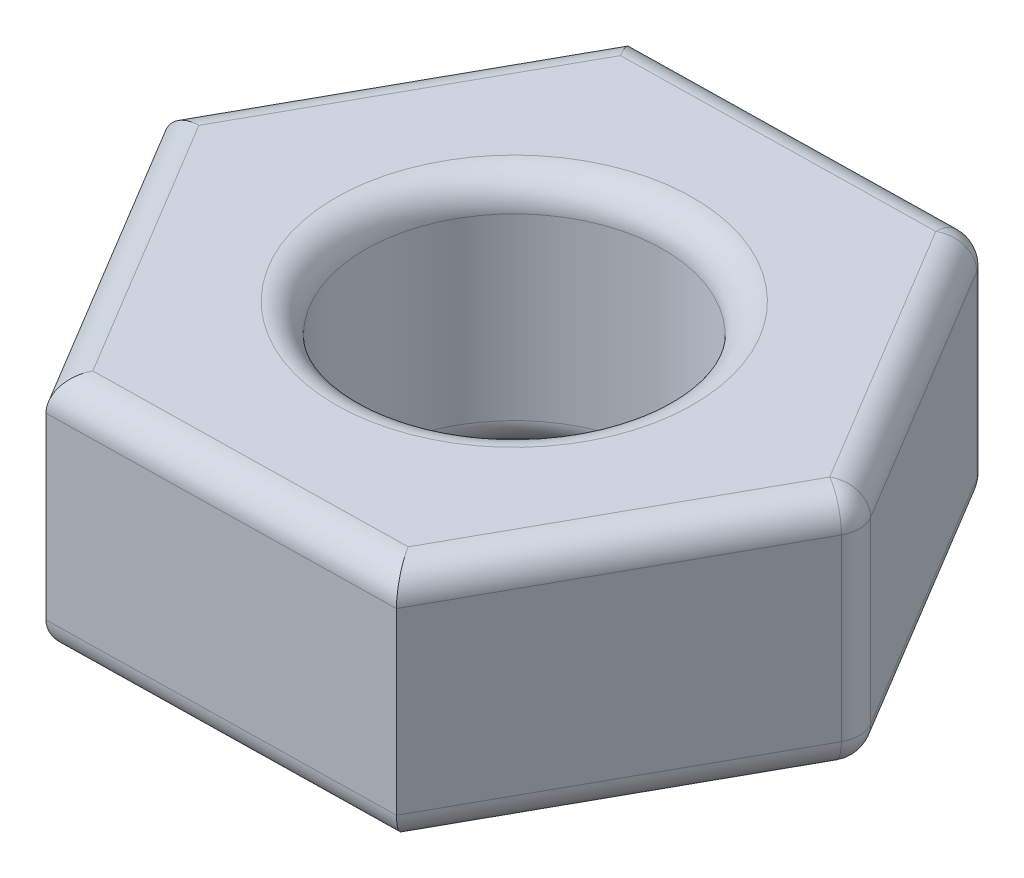
from build123d import *

# Parameters (mm, degrees)
SKETCH_1_R      = 1
EXTRUDE_1_DEPTH = 1.6
FILLET_1_R      = 0.2


with BuildPart() as part:
    # 草图1 → 凸台-拉伸1 (new body)
    with BuildSketch(Plane(origin=(0, 0, 0), x_dir=(1, 0, 0), z_dir=(0, 1, 0))):
        Polygon((1.119679768, 2.019814484), (-1.18937077, 1.979578365), (-2.309050538, -0.040236119), (-1.119679768, -2.019814484), (1.18937077, -1.979578365), (2.309050538, 0.040236119), align=None)
        with Locations(Location((0, 0, 0), (0, 0, 270))):
            Circle(SKETCH_1_R, mode=Mode.SUBTRACT)
    extrude(amount=EXTRUDE_1_DEPTH)

    # 圆角1
    fillet_1_edges = [part.edges().sort_by_distance(p)[0] for p in [
        (2.309050538, 0.8, -0.040236119),
        (1.119679768, 0.8, -2.019814484),
        (-1.749210654, 1.6, -0.969671123),
        (-1.714365153, 1.6, 1.030025301),
        (0, 0, -1),
        (0, 1.6, -1),
        (0.034845501, 1.6, 1.999696425),
        (1.749210654, 1.6, 0.969671123),
        (1.714365153, 1.6, -1.030025301),
        (1.749210654, 0, 0.969671123),
        (0.034845501, 0, 1.999696425),
        (-1.714365153, 0, 1.030025301),
        (-1.749210654, 0, -0.969671123),
        (-0.034845501, 0, -1.999696425),
        (1.714365153, 0, -1.030025301),
        (-0.034845501, 1.6, -1.999696425),
    ]]
    fillet(fillet_1_edges, radius=FILLET_1_R)


solid = part.part
